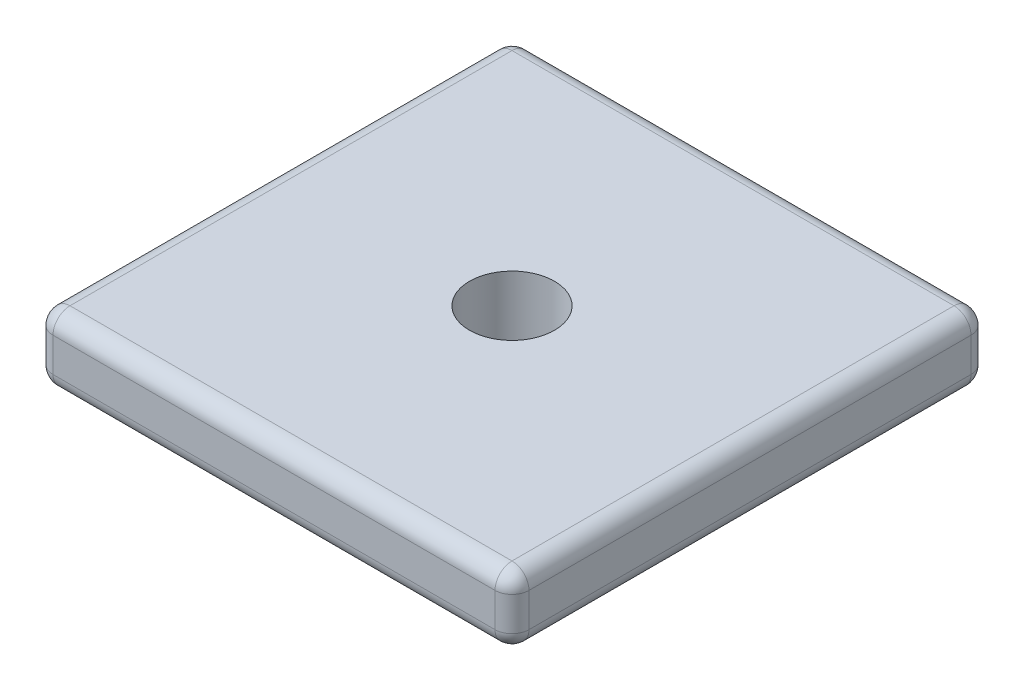
from build123d import *

# Parameters (mm, degrees)
SKETCH1_W           = 14
SKETCH1_H           = 14
BOSS_EXTRUDE1_DEPTH = 2
FILLET1_R           = 0.5
SKETCH2_R           = 1.25
CUT_EXTRUDE1_DEPTH  = 2


with BuildPart() as part:
    # Sketch1 → Boss-Extrude1 (new body)
    with BuildSketch(Plane(origin=(0, 0, 0), x_dir=(1, 0, 0), z_dir=(0, 1, 0))):
        with Locations((-77.166666667, 63)):
            Rectangle(SKETCH1_W, SKETCH1_H)
    extrude(amount=BOSS_EXTRUDE1_DEPTH)

    # Fillet1
    fillet1_edges = [part.edges().sort_by_distance(p)[0] for p in [
        (-70.166666667, 2, -63),
        (-77.166666667, 2, -70),
        (-84.166666667, 2, -63),
        (-77.166666667, 0, -70),
        (-70.166666667, 0, -63),
        (-77.166666667, 0, -56),
        (-84.166666667, 0, -63),
        (-77.166666667, 2, -56),
        (-84.166666667, 1, -70),
        (-70.166666667, 1, -70),
        (-70.166666667, 1, -56),
        (-84.166666667, 1, -56),
    ]]
    fillet(fillet1_edges, radius=FILLET1_R)

    # Sketch2 → Cut-Extrude1 (cut)
    with BuildSketch(Plane(origin=(0, 2, 0), x_dir=(1, 0, 0), z_dir=(0, 1, 0))):
        with Locations(Location((-77.166666667, 63, 0), (0, 0, 270))):
            Circle(SKETCH2_R)
    extrude(amount=-CUT_EXTRUDE1_DEPTH, mode=Mode.SUBTRACT)


solid = part.part
